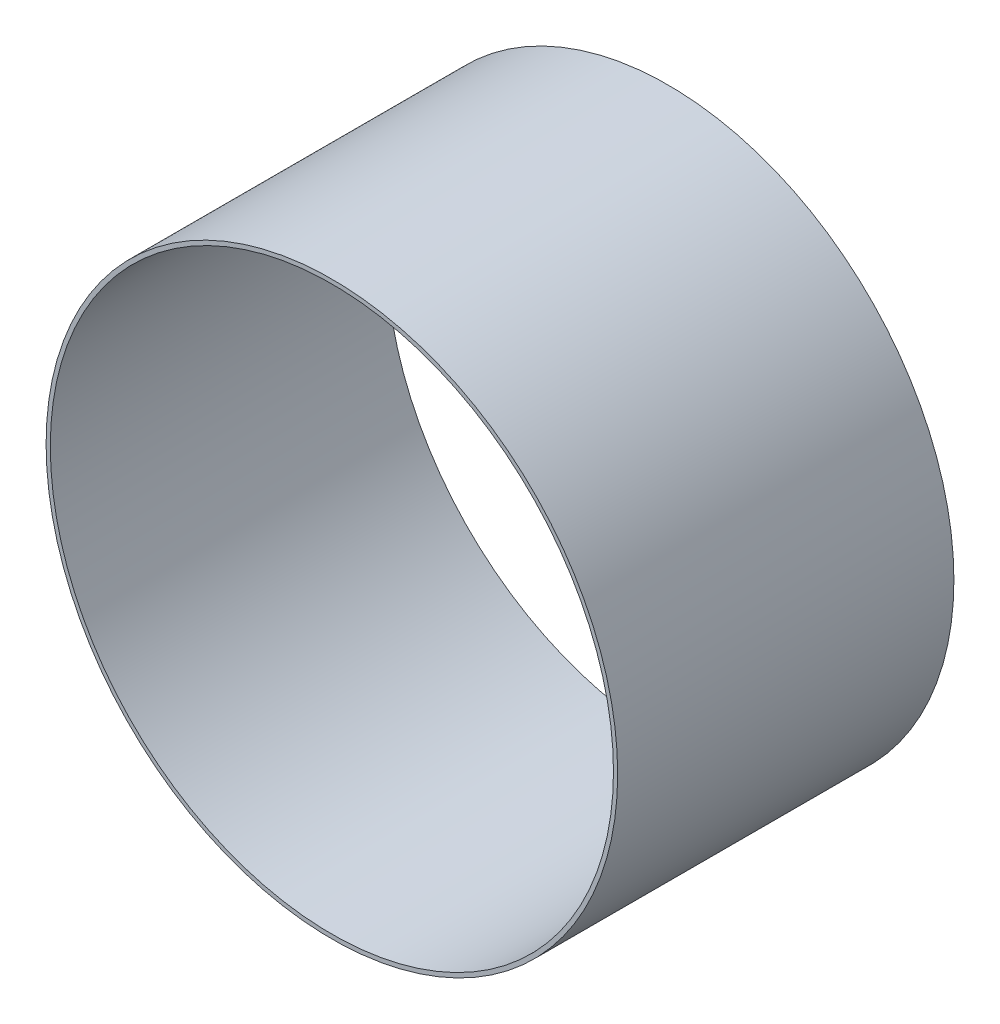
from build123d import *

# Parameters (mm, degrees)
BOSS_EXTRUDE1_DEPTH      = 40
BOSS_EXTRUDE1_DEPTH_BACK = 40
SKETCH1_R                = 68
SKETCH2_R                = 67
CUT_EXTRUDE1_DEPTH       = 80


with BuildPart() as part:
    # Sketch1 → Boss-Extrude1 (new, two sides: drawn at the far end of the back side and taken through both)
    with BuildSketch(Plane.XY.offset(-BOSS_EXTRUDE1_DEPTH_BACK)):
        Circle(SKETCH1_R)
    extrude(amount=BOSS_EXTRUDE1_DEPTH + BOSS_EXTRUDE1_DEPTH_BACK)

    # Sketch2 → Cut-Extrude1 (cut)
    with BuildSketch(Plane(origin=(0, 0, -40), x_dir=(-1, 0, 0), z_dir=(0, 0, -1))):
        Circle(SKETCH2_R)
    extrude(amount=-CUT_EXTRUDE1_DEPTH, mode=Mode.SUBTRACT)


solid = part.part
